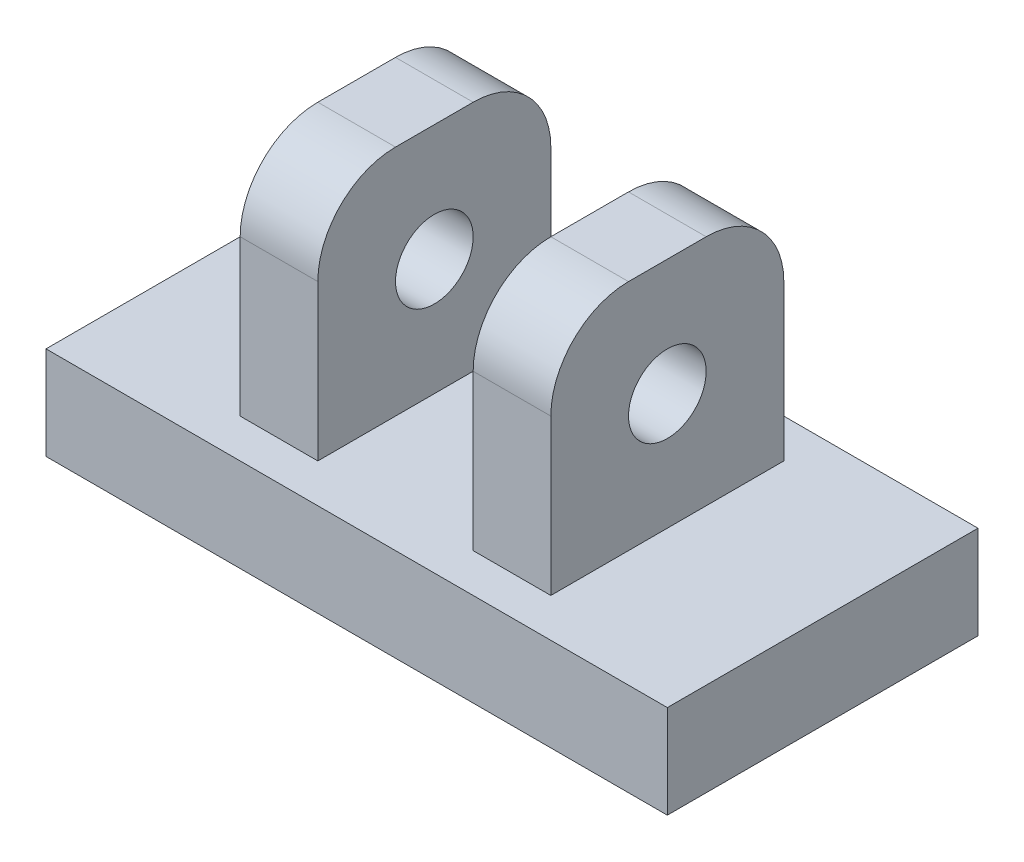
from build123d import *

# Parameters (mm, degrees)
BOSS_EXTRUDE1_DEPTH      = 10
BOSS_EXTRUDE1_DEPTH_BACK = 10
BOSS_EXTRUDE2_DEPTH      = 7.5
BOSS_EXTRUDE2_DEPTH_BACK = 7.5
SKETCH1_4_W              = 5
SKETCH1_4_H              = 15
SKETCH2_R                = 2.5
CUT_EXTRUDE1_DEPTH       = 38.960505792
FILLET1_R                = 5


with BuildPart() as part:
    # Sketch1 → Boss-Extrude1 (new, two sides: drawn at the far end of the back side and taken through both)
    with BuildSketch(Plane.XY.offset(-BOSS_EXTRUDE1_DEPTH_BACK)):
        Polygon((0, 6), (0, 0), (40, 0), (40, 6), (30, 6), (25, 6), (15, 6), (10, 6), align=None)
    extrude(amount=BOSS_EXTRUDE1_DEPTH + BOSS_EXTRUDE1_DEPTH_BACK)

    # Sketch1<4> → Boss-Extrude2 (add, two sides: drawn at the far end of the back side and taken through both)
    with BuildSketch(Plane.XY.offset(-BOSS_EXTRUDE2_DEPTH_BACK)):
        with Locations((12.5, 13.5)):
            Rectangle(SKETCH1_4_W, SKETCH1_4_H)
        with Locations((27.5, 13.5)):
            Rectangle(SKETCH1_4_W, SKETCH1_4_H)
    extrude(amount=BOSS_EXTRUDE2_DEPTH + BOSS_EXTRUDE2_DEPTH_BACK)

    # Sketch2 → Cut-Extrude1 (cut, through all)
    with BuildSketch(Plane.ZY.offset(-10)):
        with Locations((0, 13.5)):
            Circle(SKETCH2_R)
    extrude(amount=-CUT_EXTRUDE1_DEPTH, mode=Mode.SUBTRACT)

    # Fillet1
    fillet1_edges = [part.edges().sort_by_distance(p)[0] for p in [
        (12.5, 21, -7.5),
        (27.5, 21, -7.5),
        (27.5, 21, 7.5),
        (12.5, 21, 7.5),
    ]]
    fillet(fillet1_edges, radius=FILLET1_R)


solid = part.part
